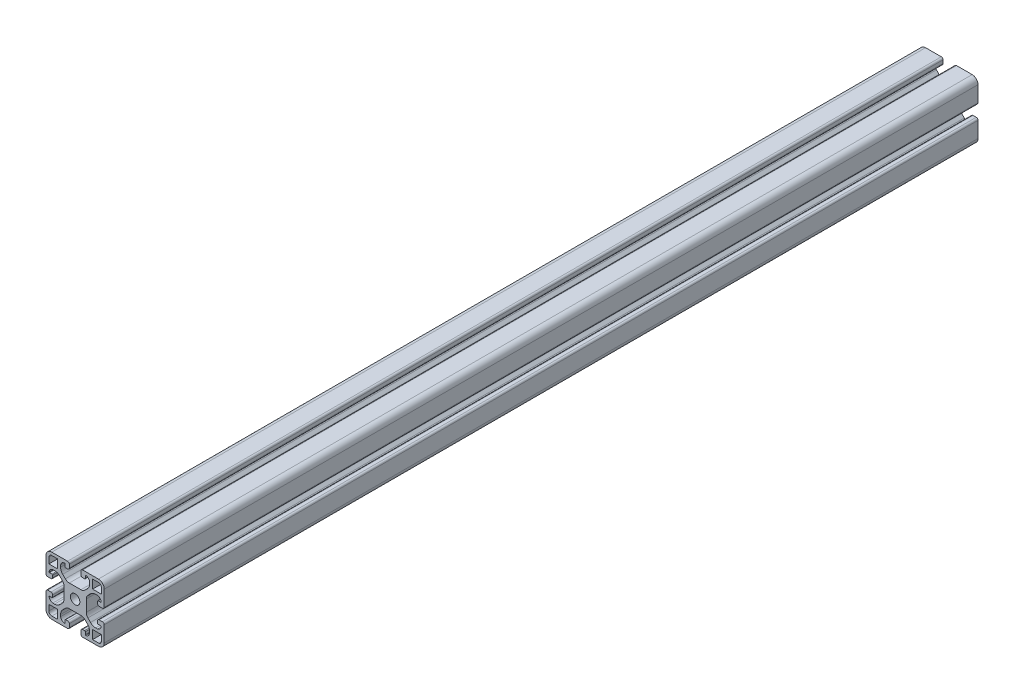
from build123d import *

# Parameters (mm, degrees)
CROQUIS1_R              = 3.25
SALIENTE_EXTRUIR1_DEPTH = 600


with BuildPart() as part:
    # Croquis1 → Saliente-Extruir1 (new body)
    with BuildSketch(Plane.XY):
        with BuildLine():
            Line((17.638588183, 7.000000593), (15.9, 7.000000593))
            ThreePointArc((15.9, 7.000000593), (15.546446609, 6.853553983), (15.4, 6.500000593))
            Line((15.4, 6.500000593), (15.4, 5.144079725))
            ThreePointArc((15.4, 5.144079725), (15.735093193, 4.335093193), (16.544079725, 4))
            Line((16.544079725, 4), (18.8, 4))
            ThreePointArc((18.8, 4), (19.648528137, 4.351471863), (20, 5.2))
            Line((20, 5.2), (20, 16))
            ThreePointArc((20, 16), (18.828427125, 18.828427125), (16, 20))
            Line((16, 20), (5.2, 20))
            ThreePointArc((5.2, 20), (4.351471862, 19.648528137), (4, 18.8))
            Line((4, 18.8), (4, 16.544079725))
            ThreePointArc((4, 16.544079725), (4.335093193, 15.735093193), (5.144079725, 15.4))
            Line((5.144079725, 15.4), (6.500000593, 15.4))
            ThreePointArc((6.500000593, 15.4), (6.853553983, 15.546446609), (7.000000593, 15.9))
            Line((7.000000593, 15.9), (7.000000593, 17.638588183))
            ThreePointArc((7.000000593, 17.638588183), (7.081377983, 17.823253941), (7.272577483, 17.887802162))
            ThreePointArc((7.272577483, 17.887802162), (9.057180209, 17.101396285), (9.99999956, 15.394254591))
            Line((9.99999956, 15.394254591), (9.99999956, 14.133359942))
            ThreePointArc((9.99999956, 14.133359942), (9.617015406, 12.207968581), (8.52636881, 10.575700602))
            Line((8.52636881, 10.575700602), (6.732513057, 8.781844848))
            ThreePointArc((6.732513057, 8.781844848), (5.47882541, 7.944157544), (4, 7.650000881))
            Line((4, 7.650000881), (-3.999999119, 7.650000881))
            ThreePointArc((-3.999999119, 7.650000881), (-5.478824529, 7.944157544), (-6.732512176, 8.781844848))
            Line((-6.732512176, 8.781844848), (-8.526367489, 10.575700161))
            ThreePointArc((-8.526367489, 10.575700161), (-9.617014085, 12.207968141), (-9.999998238, 14.133359502))
            Line((-9.999998238, 14.133359502), (-9.999998238, 15.394254272))
            ThreePointArc((-9.999998238, 15.394254272), (-9.057177493, 17.101391964), (-7.272576853, 17.887795559))
            ThreePointArc((-7.272576853, 17.887795559), (-7.081377376, 17.823247322), (-7, 17.638581577))
            Line((-7, 17.638581577), (-7, 15.9))
            ThreePointArc((-7, 15.9), (-6.853553391, 15.546446609), (-6.5, 15.4))
            Line((-6.5, 15.4), (-5.144079725, 15.4))
            ThreePointArc((-5.144079725, 15.4), (-4.335093193, 15.735093193), (-4, 16.544079725))
            Line((-4, 16.544079725), (-4, 18.8))
            ThreePointArc((-4, 18.8), (-4.351471863, 19.648528137), (-5.2, 20))
            Line((-5.2, 20), (-16, 20))
            ThreePointArc((-16, 20), (-18.828427125, 18.828427125), (-20, 16))
            Line((-20, 16), (-20, 5.2))
            ThreePointArc((-20, 5.2), (-19.648528137, 4.351471862), (-18.8, 4))
            Line((-18.8, 4), (-16.544079725, 4))
            ThreePointArc((-16.544079725, 4), (-15.735093193, 4.335093193), (-15.4, 5.144079725))
            Line((-15.4, 5.144079725), (-15.4, 6.500000593))
            ThreePointArc((-15.4, 6.500000593), (-15.546446609, 6.853553983), (-15.9, 7.000000593))
            Line((-15.9, 7.000000593), (-17.638588183, 7.000000593))
            ThreePointArc((-17.638588183, 7.000000593), (-17.823253941, 7.081377983), (-17.887802162, 7.272577483))
            ThreePointArc((-17.887802162, 7.272577483), (-17.101396286, 9.057180209), (-15.394254591, 9.99999956))
            Line((-15.394254591, 9.99999956), (-14.133359942, 9.99999956))
            ThreePointArc((-14.133359942, 9.99999956), (-12.207968582, 9.617015406), (-10.575700602, 8.52636881))
            Line((-10.575700602, 8.52636881), (-8.781844848, 6.732513057))
            ThreePointArc((-8.781844848, 6.732513057), (-7.944157544, 5.47882541), (-7.650000881, 4))
            Line((-7.650000881, 4), (-7.650000881, -3.999999119))
            ThreePointArc((-7.650000881, -3.999999119), (-7.944157544, -5.478824529), (-8.781844848, -6.732512176))
            Line((-8.781844848, -6.732512176), (-10.575700161, -8.526367489))
            ThreePointArc((-10.575700161, -8.526367489), (-12.207968141, -9.617014085), (-14.133359502, -9.999998238))
            Line((-14.133359502, -9.999998238), (-15.394254272, -9.999998238))
            ThreePointArc((-15.394254272, -9.999998238), (-17.101391964, -9.057177493), (-17.887795559, -7.272576853))
            ThreePointArc((-17.887795559, -7.272576853), (-17.823247322, -7.081377376), (-17.638581577, -7))
            Line((-17.638581577, -7), (-15.9, -7))
            ThreePointArc((-15.9, -7), (-15.546446609, -6.853553391), (-15.4, -6.5))
            Line((-15.4, -6.5), (-15.4, -5.144079725))
            ThreePointArc((-15.4, -5.144079725), (-15.735093193, -4.335093193), (-16.544079725, -4))
            Line((-16.544079725, -4), (-18.8, -4))
            ThreePointArc((-18.8, -4), (-19.648528137, -4.351471863), (-20, -5.2))
            Line((-20, -5.2), (-20, -16))
            ThreePointArc((-20, -16), (-18.828427125, -18.828427125), (-16, -20))
            Line((-16, -20), (-5.2, -20))
            ThreePointArc((-5.2, -20), (-4.351471863, -19.648528137), (-4, -18.8))
            Line((-4, -18.8), (-4, -16.544079725))
            ThreePointArc((-4, -16.544079725), (-4.335093193, -15.735093193), (-5.144079725, -15.4))
            Line((-5.144079725, -15.4), (-6.5, -15.4))
            ThreePointArc((-6.5, -15.4), (-6.853553391, -15.546446609), (-7, -15.9))
            Line((-7, -15.9), (-7, -17.638581577))
            ThreePointArc((-7, -17.638581577), (-7.081377376, -17.823247322), (-7.272576853, -17.887795559))
            ThreePointArc((-7.272576853, -17.887795559), (-9.057177493, -17.101391964), (-9.999998238, -15.394254272))
            Line((-9.999998238, -15.394254272), (-9.999998238, -14.133359502))
            ThreePointArc((-9.999998238, -14.133359502), (-9.617014085, -12.207968141), (-8.526367489, -10.575700161))
            Line((-8.526367489, -10.575700161), (-6.732512176, -8.781844848))
            ThreePointArc((-6.732512176, -8.781844848), (-5.478824529, -7.944157544), (-3.999999119, -7.650000881))
            Line((-3.999999119, -7.650000881), (4, -7.650000881))
            ThreePointArc((4, -7.650000881), (5.47882541, -7.944157544), (6.732513057, -8.781844848))
            Line((6.732513057, -8.781844848), (8.52636881, -10.575700602))
            ThreePointArc((8.52636881, -10.575700602), (9.617015406, -12.207968582), (9.99999956, -14.133359942))
            Line((9.99999956, -14.133359942), (9.99999956, -15.394254591))
            ThreePointArc((9.99999956, -15.394254591), (9.057180209, -17.101396286), (7.272577483, -17.887802162))
            ThreePointArc((7.272577483, -17.887802162), (7.081377983, -17.823253941), (7.000000593, -17.638588183))
            Line((7.000000593, -17.638588183), (7.000000593, -15.9))
            ThreePointArc((7.000000593, -15.9), (6.853553983, -15.546446609), (6.500000593, -15.4))
            Line((6.500000593, -15.4), (5.144079725, -15.4))
            ThreePointArc((5.144079725, -15.4), (4.335093193, -15.735093193), (4, -16.544079725))
            Line((4, -16.544079725), (4, -18.8))
            ThreePointArc((4, -18.8), (4.351471862, -19.648528137), (5.2, -20))
            Line((5.2, -20), (16, -20))
            ThreePointArc((16, -20), (18.828427125, -18.828427125), (20, -16))
            Line((20, -16), (20, -5.2))
            ThreePointArc((20, -5.2), (19.648528137, -4.351471863), (18.8, -4))
            Line((18.8, -4), (16.544079725, -4))
            ThreePointArc((16.544079725, -4), (15.735093193, -4.335093193), (15.4, -5.144079725))
            Line((15.4, -5.144079725), (15.4, -6.5))
            ThreePointArc((15.4, -6.5), (15.546446609, -6.853553391), (15.9, -7))
            Line((15.9, -7), (17.638581577, -7))
            ThreePointArc((17.638581577, -7), (17.823247322, -7.081377376), (17.887795559, -7.272576853))
            ThreePointArc((17.887795559, -7.272576853), (17.101391964, -9.057177493), (15.394254272, -9.999998238))
            Line((15.394254272, -9.999998238), (14.133359502, -9.999998238))
            ThreePointArc((14.133359502, -9.999998238), (12.207968141, -9.617014085), (10.575700161, -8.526367489))
            Line((10.575700161, -8.526367489), (8.781844848, -6.732512176))
            ThreePointArc((8.781844848, -6.732512176), (7.944157544, -5.478824529), (7.650000881, -3.999999119))
            Line((7.650000881, -3.999999119), (7.650000881, 4))
            ThreePointArc((7.650000881, 4), (7.944157544, 5.47882541), (8.781844848, 6.732513057))
            Line((8.781844848, 6.732513057), (10.575700602, 8.52636881))
            ThreePointArc((10.575700602, 8.52636881), (12.207968581, 9.617015406), (14.133359942, 9.99999956))
            Line((14.133359942, 9.99999956), (15.394254591, 9.99999956))
            ThreePointArc((15.394254591, 9.99999956), (17.101396285, 9.057180209), (17.887802162, 7.272577483))
            ThreePointArc((17.887802162, 7.272577483), (17.823253941, 7.081377983), (17.638588183, 7.000000593))
        make_face()
        Circle(CROQUIS1_R, mode=Mode.SUBTRACT)
        with BuildLine():
            Line((-12, -18), (-16, -18))
            ThreePointArc((-16, -18), (-17.414213562, -17.414213562), (-18, -16))
            Line((-18, -16), (-18, -12))
            Line((-18, -12), (-12, -12))
            Line((-12, -12), (-12, -18))
        make_face(mode=Mode.SUBTRACT)
        with BuildLine():
            Line((18, -16), (18, -12))
            Line((18, -12), (12, -12))
            Line((12, -12), (12, -18))
            Line((12, -18), (16, -18))
            ThreePointArc((16, -18), (17.414213562, -17.414213562), (18, -16))
        make_face(mode=Mode.SUBTRACT)
        with BuildLine():
            Line((16, 18), (12, 18))
            Line((12, 18), (12, 12))
            Line((12, 12), (18, 12))
            Line((18, 12), (18, 16))
            ThreePointArc((18, 16), (17.414213562, 17.414213562), (16, 18))
        make_face(mode=Mode.SUBTRACT)
        with BuildLine():
            Line((-18, 16), (-18, 12))
            Line((-18, 12), (-12, 12))
            Line((-12, 12), (-12, 18))
            Line((-12, 18), (-16, 18))
            ThreePointArc((-16, 18), (-17.414213562, 17.414213562), (-18, 16))
        make_face(mode=Mode.SUBTRACT)
    extrude(amount=SALIENTE_EXTRUIR1_DEPTH)


solid = part.part
